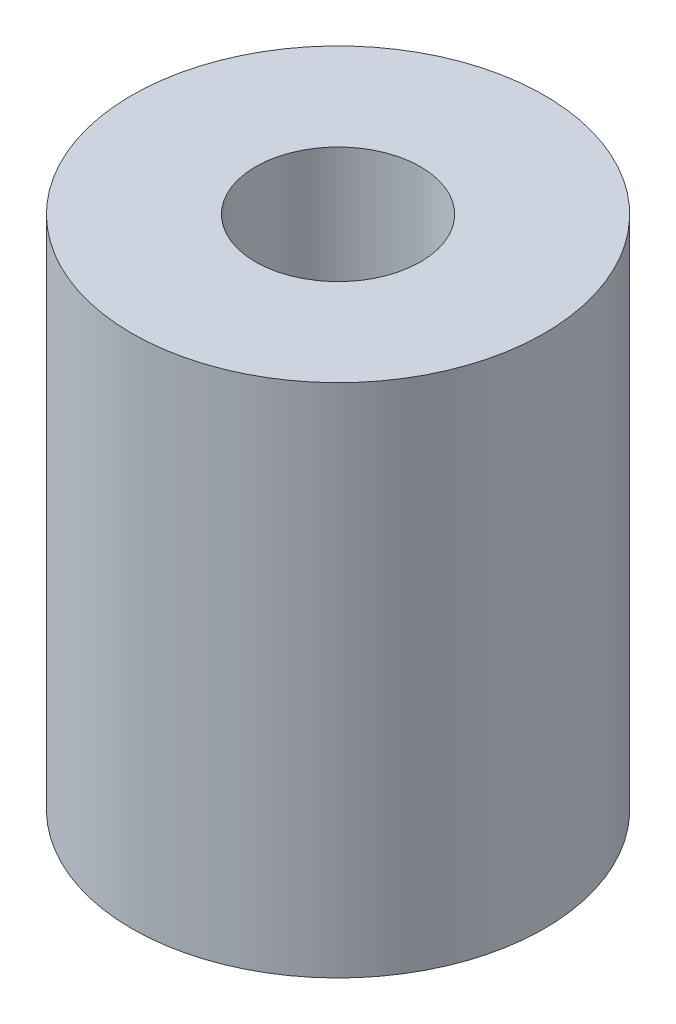
from build123d import *

# Parameters (mm, degrees)
SKETCH2_R           = 10
SKETCH2_R_2         = 4
BOSS_EXTRUDE1_DEPTH = 25


with BuildPart() as part:
    # Sketch2 → Boss-Extrude1 (new body)
    with BuildSketch(Plane(origin=(0, 0, 0), x_dir=(1, 0, 0), z_dir=(0, 1, 0))):
        with Locations(Location((0, 0, 0), (0, 0, 270))):
            Circle(SKETCH2_R)
        with Locations(Location((0, 0, 0), (0, 0, 270))):
            Circle(SKETCH2_R_2, mode=Mode.SUBTRACT)
    extrude(amount=BOSS_EXTRUDE1_DEPTH)


solid = part.part
